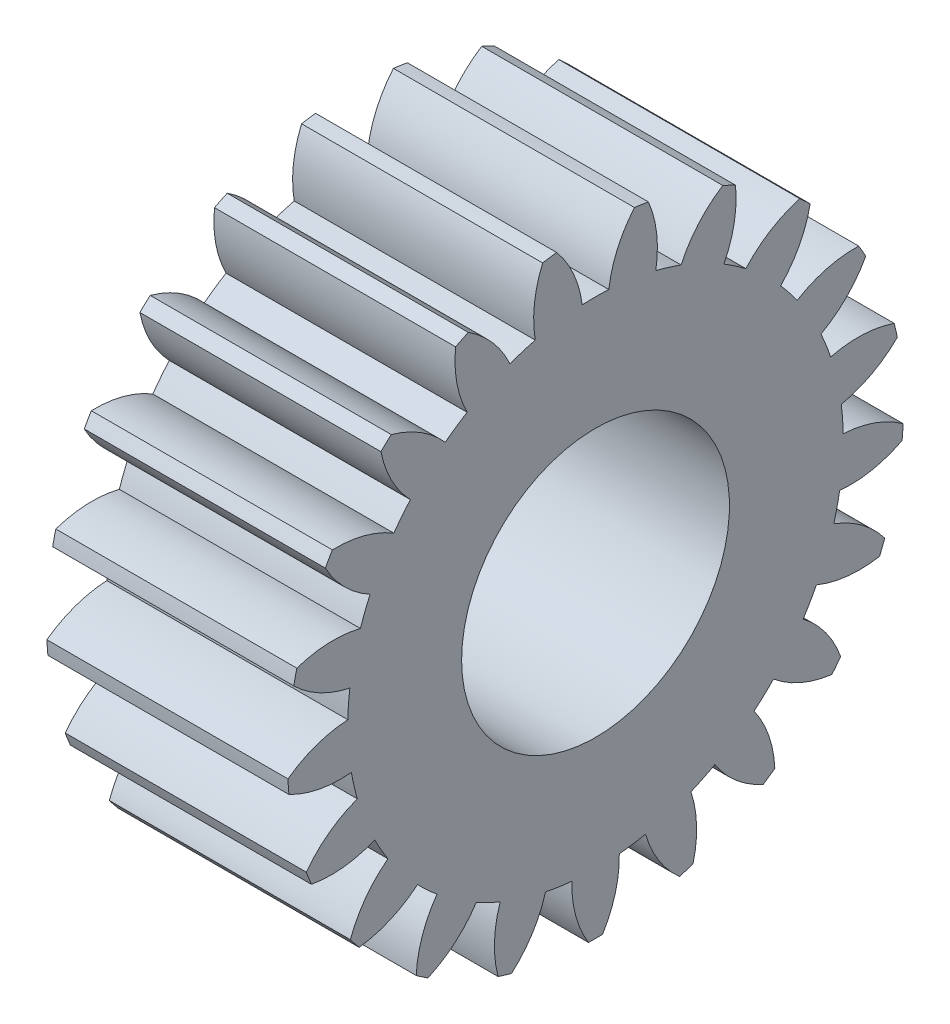
from build123d import *

# Parameters (mm, degrees)
BASPROSKE_W     = 9
BASPROSKE_H     = 11.5
TOOTHCUT_DEPTH  = 19.587630295
TEETHCUTS_COUNT = 21
TEETHCUTS_ANGLE = 342.857142857
BORSKE_R        = 5
BORE_DEPTH      = 50.0000508


with BuildPart() as part:
    # BasProSke → Base-Revolve (revolve)
    with BuildSketch(Plane(origin=(0, 0, 0), x_dir=(1, 0, 0), z_dir=(0, 1, 0)), mode=Mode.PRIVATE) as base_revolve_sk:
        with Locations((4.5, 5.75)):
            Rectangle(BASPROSKE_W, BASPROSKE_H)
    revolve(base_revolve_sk.sketch.rotate(Axis((-10, 0, 0), (1, 0, 0)), 180), axis=Axis((-10, 0, 0), (1, 0, 0)))

    # TooCutSke → ToothCut (cut, through all)
    with BuildSketch(Plane(origin=(0, 0, 0), x_dir=(0, 0, -1), z_dir=(1, 0, 0))):
        with BuildLine():
            ThreePointArc((0.49526894, 9.235730057), (0, 9.249), (-0.49526894, 9.235730057))
            ThreePointArc((-0.49526894, 9.235730057), (-0.823521057, 10.404716786), (-1.472455249, 11.430954496))
            ThreePointArc((-1.472455249, 11.430954496), (0, 11.5254), (1.472455249, 11.430954496))
            ThreePointArc((1.472455249, 11.430954496), (0.823521057, 10.404716786), (0.49526894, 9.235730057))
        make_face()
    toothcut = extrude(amount=TOOTHCUT_DEPTH, mode=Mode.SUBTRACT)

    # TeethCuts: ToothCut ×21 about axis
    teethcuts_axis = Axis((-10, 0, 0), (1, 0, 0))
    for i in range(1, TEETHCUTS_COUNT):
        add(toothcut.rotate(teethcuts_axis, i * TEETHCUTS_ANGLE / (TEETHCUTS_COUNT - 1)), mode=Mode.SUBTRACT)

    # BorSke → Bore (cut, symmetric)
    with BuildSketch(Plane(origin=(0, 0, 0), x_dir=(0, 0, -1), z_dir=(1, 0, 0))):
        with Locations(Location((0, 0, 0), (0, 0, 180))):
            Circle(BORSKE_R)
    extrude(amount=BORE_DEPTH, both=True, mode=Mode.SUBTRACT)


solid = part.part
